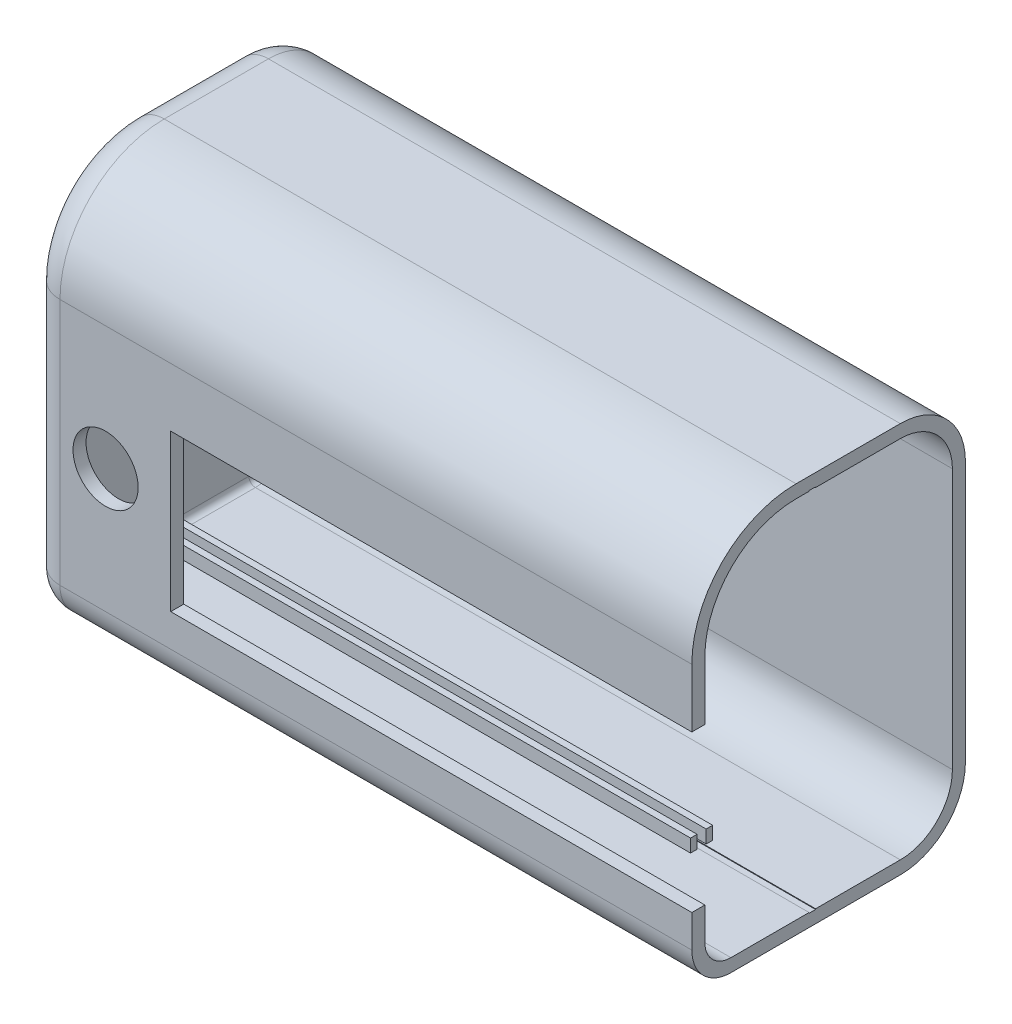
from build123d import *

# Parameters (mm, degrees)
SKETCH_1_W                  = 1
SKETCH_1_H                  = 1.9
SKETCH_1_W_2                = 2
SKETCH_1_H_2                = 60
EXTRUDE_1_DEPTH             = 90
SKETCH_2_W                  = 2
SKETCH_2_H                  = 24
CUT_EXTRUDE_1_DEPTH         = 117.034477635
SKETCH_4_W                  = 1
SKETCH_4_H                  = 0.1
EXTRUDE_2_DEPTH             = 3
SKETCH_5_W                  = 2
SKETCH_5_H                  = 24
EXTRUDE_3_DEPTH             = 10
SKETCH_6_W                  = 42
SKETCH_6_H                  = 60
EXTRUDE_4_DEPTH             = 2
EXTRUDE_5_REACH             = 122.702
SKETCH_8_W                  = 10
SKETCH_8_H                  = 2
CUT_EXTRUDE_2_REACH         = 127.571
SKETCH_7_R                  = 5
FILLET_1_R                  = 14
FILLET_2_R                  = 16
FILLET_4_R                  = 8
FILLET_5_R                  = 10
FILLET_6_R                  = 4
FILLET_7_R                  = 6
FILLET_8_R                  = 5
FILLET_9_R                  = 1
EXTRUDE_6_REACH             = 115.723
SKETCH_10_W                 = 1
SKETCH_10_H                 = 1
EXTRUDE_6_DIRECTION_2_DEPTH = 20
SKETCH_11_W                 = 1
SKETCH_11_H                 = 1
EXTRUDE_7_DEPTH             = 50
SKETCH_12_W                 = 33
SKETCH_12_H                 = 1
EXTRUDE_8_DEPTH             = 10
SKETCH_13_W                 = 83
SKETCH_13_H                 = 1
EXTRUDE_9_DEPTH             = 1


with BuildPart() as part:
    # Эскиз1 → Бобышка-Вытянуть1 (new body)
    with BuildSketch(Plane(origin=(0, 0, 0), x_dir=(0, 0, -1), z_dir=(1, 0, 0))):
        Polygon((18, 60), (2, 60), (2, 58), (18, 58), (18, 58.1), align=None)
        with Locations((18.5, 59.05)):
            Rectangle(SKETCH_1_W, SKETCH_1_H)
        Polygon((40, 60), (19, 60), (19, 58.1), (19, 58), (40, 58), align=None)
        with Locations((1, 30)):
            Rectangle(SKETCH_1_W_2, SKETCH_1_H_2)
        Polygon((40, 2), (40, 0), (42, 0), (42, 60), (40, 60), (40, 58), align=None)
        Polygon((19, 1.9), (19, 0), (40, 0), (40, 2), (19, 2), align=None)
        with Locations((18.5, 0.95)):
            Rectangle(SKETCH_1_W, SKETCH_1_H)
        Polygon((2, 2), (2, 0), (18, 0), (18, 1.9), (18, 2), align=None)
    extrude(amount=-EXTRUDE_1_DEPTH)

    # Эскиз2 → Вырез-Вытянуть1 (cut, through all)
    with BuildSketch(Plane(origin=(0, 0, 0), x_dir=(0, 0, -1), z_dir=(1, 0, 0))):
        with Locations((1, 23)):
            Rectangle(SKETCH_2_W, SKETCH_2_H)
    extrude(amount=-CUT_EXTRUDE_1_DEPTH, mode=Mode.SUBTRACT)

    # Эскиз4 → Бобышка-Вытянуть2 (add)
    with BuildSketch(Plane.ZY.offset(90)):
        with Locations((-18.5, 58.05)):
            Rectangle(SKETCH_4_W, SKETCH_4_H)
        with Locations((-18.5, 1.95)):
            Rectangle(SKETCH_4_W, SKETCH_4_H)
    extrude(amount=-EXTRUDE_2_DEPTH)

    # Эскиз5 → Бобышка-Вытянуть3 (add)
    with BuildSketch(Plane.ZY.offset(90)):
        Polygon((0, 11), (-2, 11), (-2, 2), (-40, 2), (-40, 58), (-2, 58), (-2, 35), (0, 35), (0, 60), (-42, 60), (-42, 0), (0, 0), align=None)
        with Locations((-1, 23)):
            Rectangle(SKETCH_5_W, SKETCH_5_H)
    extrude(amount=EXTRUDE_3_DEPTH)

    # Эскиз6 → Бобышка-Вытянуть4 (add)
    with BuildSketch(Plane.ZY.offset(100)):
        with Locations((-21, 30)):
            Rectangle(SKETCH_6_W, SKETCH_6_H)
    extrude(amount=EXTRUDE_4_DEPTH)

    # Эскиз8 → Бобышка-Вытянуть5 (add, up to next)
    with BuildSketch(Plane(origin=(0, 11, 0), x_dir=(1, 0, 0), z_dir=(0, 1, 0)), mode=Mode.PRIVATE) as extrude_5_sk1:
        with Locations((-85, 1)):
            Rectangle(SKETCH_8_W, SKETCH_8_H)
    extrude_5_tool1 = extrude(extrude_5_sk1.sketch, amount=EXTRUDE_5_REACH, mode=Mode.PRIVATE) - part.part
    add(extrude_5_tool1.solids().sort_by_distance((-85, 11, -1))[0])

    # Эскиз7 → Вырез-Вытянуть2 (cut, up to next)
    with BuildSketch(Plane.XY, mode=Mode.PRIVATE) as cut_extrude_2_sk1:
        with Locations((-90, 25)):
            Circle(SKETCH_7_R)
    cut_extrude_2_tool1 = extrude(cut_extrude_2_sk1.sketch, amount=-CUT_EXTRUDE_2_REACH, mode=Mode.PRIVATE) & part.part
    add(cut_extrude_2_tool1.solids().sort_by_distance((-90, 25, 0))[0], mode=Mode.SUBTRACT)

    # Скругление1
    fillet_1_edges = [part.edges().sort_by_distance(p)[0] for p in [
        (-50, 58, -2),
    ]]
    fillet(fillet_1_edges, radius=FILLET_1_R)

    # Скругление2
    fillet_2_edges = [part.edges().sort_by_distance(p)[0] for p in [
        (-51, 60, 0),
    ]]
    fillet(fillet_2_edges, radius=FILLET_2_R)

    # Скругление4
    fillet_4_edges = [part.edges().sort_by_distance(p)[0] for p in [
        (-50, 2, -40),
        (-50, 58, -40),
    ]]
    fillet(fillet_4_edges, radius=FILLET_4_R)

    # Скругление5
    fillet_5_edges = [part.edges().sort_by_distance(p)[0] for p in [
        (-51, 60, -42),
        (-51, 0, -42),
    ]]
    fillet(fillet_5_edges, radius=FILLET_5_R)

    # Скругление6
    fillet_6_edges = [part.edges().sort_by_distance(p)[0] for p in [
        (-50, 2, -2),
    ]]
    fillet(fillet_6_edges, radius=FILLET_6_R)

    # Скругление7
    fillet_7_edges = [part.edges().sort_by_distance(p)[0] for p in [
        (-51, 0, 0),
    ]]
    fillet(fillet_7_edges, radius=FILLET_7_R)

    # Скругление8
    fillet_8_edges = [part.edges().sort_by_distance(p)[0] for p in [
        (-102, 60, -24),
        (-102, 55.313708499, -4.686291501),
        (-102, 0, -19),
        (-102, 30, -42),
        (-102, 57.071067812, -39.071067812),
        (-102, 2.928932188, -39.071067812),
        (-102, 25, 0),
        (-102, 1.757359313, -1.757359313),
    ]]
    fillet(fillet_8_edges, radius=FILLET_8_R)

    # Скругление9
    fillet_9_edges = [part.edges().sort_by_distance(p)[0] for p in [
        (-100, 25, -2),
        (-100, 53.899494937, -6.100505063),
        (-100, 30, -40),
        (-100, 58, -24),
        (-100, 55.656854249, -37.656854249),
        (-100, 4.343145751, -37.656854249),
        (-100, 2, -19),
        (-100, 3.171572875, -3.171572875),
    ]]
    fillet(fillet_9_edges, radius=FILLET_9_R)

    # Эскиз10 → Бобышка-Вытянуть6 (add, up to next)
    with BuildSketch(Plane(origin=(-87, 0, 0), x_dir=(0, 0, -1), z_dir=(1, 0, 0)), mode=Mode.PRIVATE) as extrude_6_sk1:
        with Locations((17.3, 57.5)):
            Rectangle(SKETCH_10_W, SKETCH_10_H)
    extrude_6_tool1 = extrude(extrude_6_sk1.sketch, amount=-EXTRUDE_6_REACH, mode=Mode.PRIVATE) - part.part
    # Эскиз10 → Бобышка-Вытянуть6 (add, up to next)
    with BuildSketch(Plane(origin=(-87, 0, 0), x_dir=(0, 0, -1), z_dir=(1, 0, 0)), mode=Mode.PRIVATE) as extrude_6_sk2:
        with Locations((19.7, 57.5)):
            Rectangle(SKETCH_10_W, SKETCH_10_H)
    extrude_6_tool2 = extrude(extrude_6_sk2.sketch, amount=-EXTRUDE_6_REACH, mode=Mode.PRIVATE) - part.part
    extrude_6_1 = extrude_6_tool1.solids().sort_by_distance((-87, 57.5, -17.3))[0]
    add(extrude_6_1)
    extrude_6_2 = extrude_6_tool2.solids().sort_by_distance((-87, 57.5, -19.7))[0]
    add(extrude_6_2)
    extrude_6 = extrude_6_1 + extrude_6_2  # Бобышка-Вытянуть6 as one shape, for the pattern or mirror that repeats it

    # Эскиз10 → Бобышка-Вытянуть6 direction 2 (add)
    with BuildSketch(Plane(origin=(-87, 0, 0), x_dir=(0, 0, -1), z_dir=(1, 0, 0))):
        with Locations((17.3, 57.5)):
            Rectangle(SKETCH_10_W, SKETCH_10_H)
        with Locations((19.7, 57.5)):
            Rectangle(SKETCH_10_W, SKETCH_10_H)
    extrude_6_direction_2 = extrude(amount=EXTRUDE_6_DIRECTION_2_DEPTH)

    # Зеркальное отражение1: Бобышка-Вытянуть6, Бобышка-Вытянуть6 direction 2 across plane
    add(extrude_6.mirror(Plane(origin=(0, 30, 0), x_dir=(0, 0, 1), z_dir=(0, -1, 0))))
    add(extrude_6_direction_2.mirror(Plane(origin=(0, 30, 0), x_dir=(0, 0, 1), z_dir=(0, -1, 0))))

    # Эскиз11 → Бобышка-Вытянуть7 (add)
    with BuildSketch(Plane(origin=(-67, 0, 0), x_dir=(0, 0, -1), z_dir=(1, 0, 0))):
        with Locations((19.7, 2.5)):
            Rectangle(SKETCH_11_W, SKETCH_11_H)
        with Locations((17.3, 2.5)):
            Rectangle(SKETCH_11_W, SKETCH_11_H)
    extrude(amount=EXTRUDE_7_DEPTH)

    # Эскиз12 → Бобышка-Вытянуть8 (add)
    with BuildSketch(Plane.XZ.offset(-57)):
        with Locations((-83.5, -17.3)):
            Rectangle(SKETCH_12_W, SKETCH_12_H)
        with Locations((-83.5, -19.7)):
            Rectangle(SKETCH_12_W, SKETCH_12_H)
    extrude(amount=EXTRUDE_8_DEPTH)

    # Эскиз13 → Бобышка-Вытянуть9 (add)
    with BuildSketch(Plane(origin=(0, 3, 0), x_dir=(1, 0, 0), z_dir=(0, 1, 0))):
        with Locations((-58.5, 19.7)):
            Rectangle(SKETCH_13_W, SKETCH_13_H)
        with Locations((-58.5, 17.3)):
            Rectangle(SKETCH_13_W, SKETCH_13_H)
    extrude(amount=EXTRUDE_9_DEPTH)


solid = part.part
